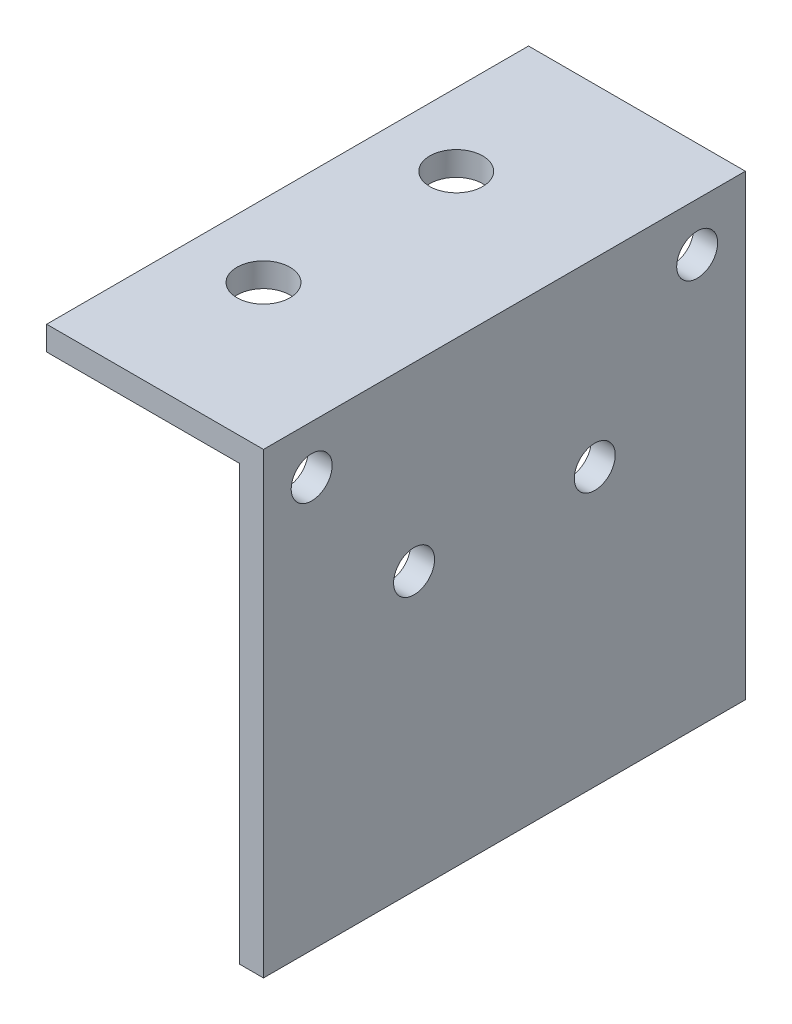
from build123d import *

# Parameters (mm, degrees)
EXTRUDE_1_DEPTH     = 40
CUT_EXTRUDE_1_REACH = 60.034
SKETCH_2_R          = 2.2
CUT_EXTRUDE_2_REACH = 60.034
SKETCH_3_R          = 1.7


with BuildPart() as part:
    # 草图1 → 凸台-拉伸1 (new body)
    with BuildSketch(Plane.XY):
        Polygon((0, 0), (18, 0), (18, -38), (16, -38), (16, -2), (0, -2), align=None)
    extrude(amount=EXTRUDE_1_DEPTH)

    # 草图2 → 切除-拉伸1 (cut, up to next)
    with BuildSketch(Plane(origin=(0, 0, 0), x_dir=(1, 0, 0), z_dir=(0, 1, 0)), mode=Mode.PRIVATE) as cut_extrude_1_sk1:
        with Locations(Location((6, -28, 0), (0, 0, 270))):
            Circle(SKETCH_2_R)
    cut_extrude_1_tool1 = extrude(cut_extrude_1_sk1.sketch, amount=-CUT_EXTRUDE_1_REACH, mode=Mode.PRIVATE) & part.part
    # 草图2 → 切除-拉伸1 (cut, up to next)
    with BuildSketch(Plane(origin=(0, 0, 0), x_dir=(1, 0, 0), z_dir=(0, 1, 0)), mode=Mode.PRIVATE) as cut_extrude_1_sk2:
        with Locations(Location((6, -12, 0), (0, 0, 270))):
            Circle(SKETCH_2_R)
    cut_extrude_1_tool2 = extrude(cut_extrude_1_sk2.sketch, amount=-CUT_EXTRUDE_1_REACH, mode=Mode.PRIVATE) & part.part
    add(cut_extrude_1_tool1.solids().sort_by_distance((6, 0, 28))[0], mode=Mode.SUBTRACT)
    add(cut_extrude_1_tool2.solids().sort_by_distance((6, 0, 12))[0], mode=Mode.SUBTRACT)

    # 草图3 → 切除-拉伸2 (cut, up to next)
    with BuildSketch(Plane(origin=(18, 0, 0), x_dir=(0, 0, -1), z_dir=(1, 0, 0)), mode=Mode.PRIVATE) as cut_extrude_2_sk1:
        with Locations(Location((-27.5, -15, 0), (0, 0, 90))):
            Circle(SKETCH_3_R)
    cut_extrude_2_tool1 = extrude(cut_extrude_2_sk1.sketch, amount=-CUT_EXTRUDE_2_REACH, mode=Mode.PRIVATE) & part.part
    # 草图3 → 切除-拉伸2 (cut, up to next)
    with BuildSketch(Plane(origin=(18, 0, 0), x_dir=(0, 0, -1), z_dir=(1, 0, 0)), mode=Mode.PRIVATE) as cut_extrude_2_sk2:
        with Locations(Location((-12.5, -15, 0), (0, 0, 90))):
            Circle(SKETCH_3_R)
    cut_extrude_2_tool2 = extrude(cut_extrude_2_sk2.sketch, amount=-CUT_EXTRUDE_2_REACH, mode=Mode.PRIVATE) & part.part
    # 草图3 → 切除-拉伸2 (cut, up to next)
    with BuildSketch(Plane(origin=(18, 0, 0), x_dir=(0, 0, -1), z_dir=(1, 0, 0)), mode=Mode.PRIVATE) as cut_extrude_2_sk3:
        with Locations(Location((-36, -4, 0), (0, 0, 90))):
            Circle(SKETCH_3_R)
    cut_extrude_2_tool3 = extrude(cut_extrude_2_sk3.sketch, amount=-CUT_EXTRUDE_2_REACH, mode=Mode.PRIVATE) & part.part
    # 草图3 → 切除-拉伸2 (cut, up to next)
    with BuildSketch(Plane(origin=(18, 0, 0), x_dir=(0, 0, -1), z_dir=(1, 0, 0)), mode=Mode.PRIVATE) as cut_extrude_2_sk4:
        with Locations(Location((-4, -4, 0), (0, 0, 90))):
            Circle(SKETCH_3_R)
    cut_extrude_2_tool4 = extrude(cut_extrude_2_sk4.sketch, amount=-CUT_EXTRUDE_2_REACH, mode=Mode.PRIVATE) & part.part
    add(cut_extrude_2_tool1.solids().sort_by_distance((18, -15, 27.5))[0], mode=Mode.SUBTRACT)
    add(cut_extrude_2_tool2.solids().sort_by_distance((18, -15, 12.5))[0], mode=Mode.SUBTRACT)
    add(cut_extrude_2_tool3.solids().sort_by_distance((18, -4, 36))[0], mode=Mode.SUBTRACT)
    add(cut_extrude_2_tool4.solids().sort_by_distance((18, -4, 4))[0], mode=Mode.SUBTRACT)


solid = part.part
